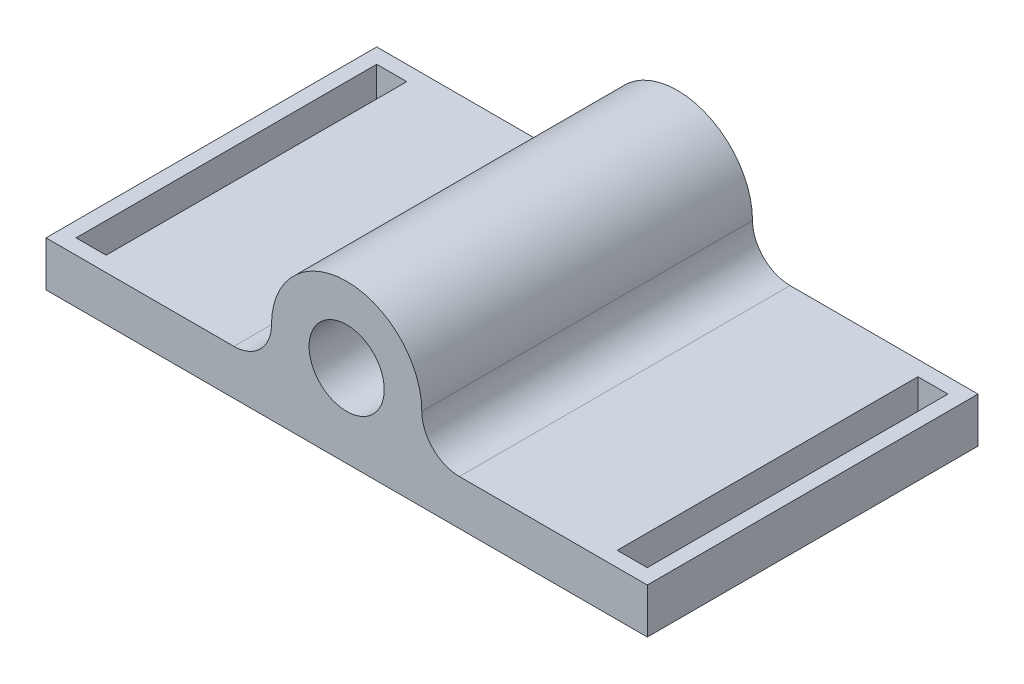
from build123d import *

# Parameters (mm, degrees)
SKETCH1_R           = 2.5
BOSS_EXTRUDE1_DEPTH = 22
SKETCH3_W           = 2
SKETCH3_H           = 20
CUT_EXTRUDE1_DEPTH  = 15


with BuildPart() as part:
    # Sketch1 → Boss-Extrude1 (new body)
    with BuildSketch(Plane.XY):
        with BuildLine():
            Line((-27.5, 4.630713194), (12.5, 4.630713194))
            Line((12.5, 4.630713194), (12.5, 7.630713194))
            Line((12.5, 7.630713194), (0, 7.630713194))
            ThreePointArc((0, 7.630713194), (-1.767766953, 8.362946241), (-2.5, 10.130713194))
            ThreePointArc((-2.5, 10.130713194), (-7.5, 15.130713194), (-12.5, 10.130713194))
            ThreePointArc((-12.5, 10.130713194), (-13.232233047, 8.362946241), (-15, 7.630713194))
            Line((-15, 7.630713194), (-27.5, 7.630713194))
            Line((-27.5, 7.630713194), (-27.5, 4.630713194))
        make_face()
        with Locations((-7.5, 10.130713194)):
            Circle(SKETCH1_R, mode=Mode.SUBTRACT)
    extrude(amount=BOSS_EXTRUDE1_DEPTH)

    # Sketch3 → Cut-Extrude1 (cut)
    with BuildSketch(Plane(origin=(0, 7.630713194, 0), x_dir=(1, 0, 0), z_dir=(0, 1, 0))):
        with Locations((-25.5, -11)):
            Rectangle(SKETCH3_W, SKETCH3_H)
        with Locations((10.5, -11)):
            Rectangle(SKETCH3_W, SKETCH3_H)
    extrude(amount=-CUT_EXTRUDE1_DEPTH, mode=Mode.SUBTRACT)


solid = part.part
